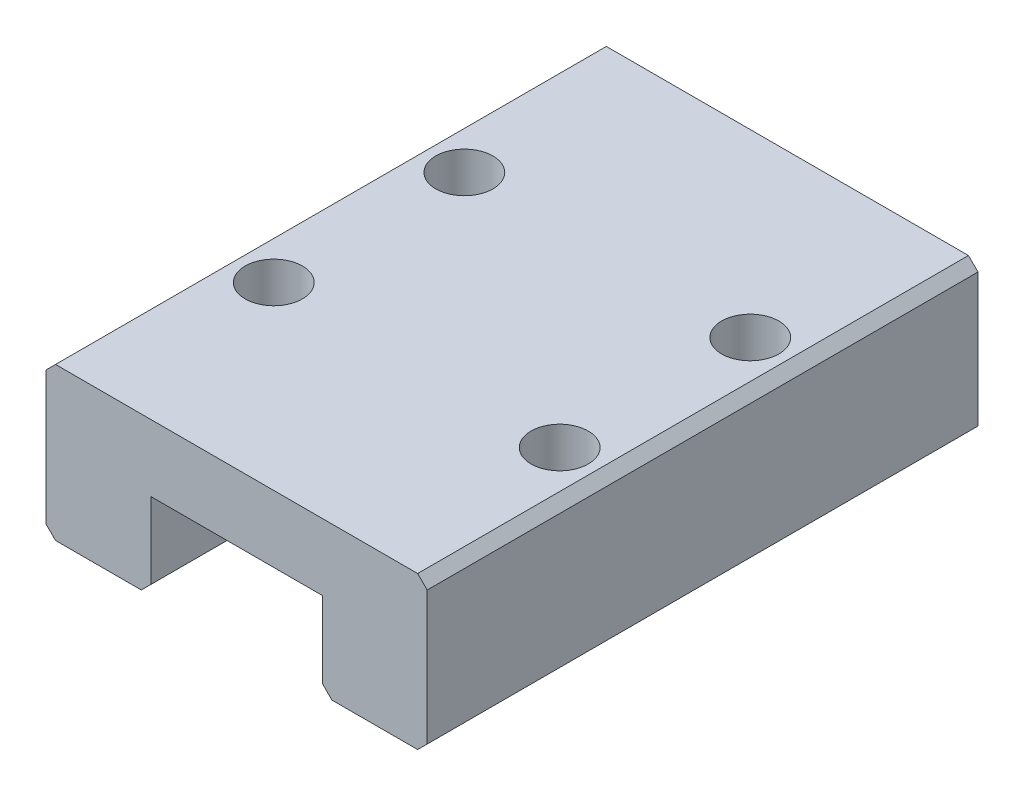
from build123d import *

# Parameters (mm, degrees)
EXTRUDE_1_DEPTH     = 14.45
SKETCH_2_R          = 1.5
CUT_EXTRUDE_1_DEPTH = 3
CHAMFER_1_SIZE      = 0.5


with BuildPart() as part:
    # 草图1 → 凸台-拉伸1 (new, symmetric)
    with BuildSketch(Plane.XY):
        Polygon((-4.5, 0), (-4.5, -4.5), (-10, -4.5), (-10, 3.5), (10, 3.5), (10, -4.5), (4.5, -4.5), (4.5, 0), align=None)
    extrude(amount=EXTRUDE_1_DEPTH, both=True)

    # 草图2 → 切除-拉伸1 (cut)
    with BuildSketch(Plane(origin=(0, 3.5, 0), x_dir=(1, 0, 0), z_dir=(0, 1, 0))):
        with Locations(Location((-7.5, 5, 0), (0, 0, 180))):
            Circle(SKETCH_2_R)
        with Locations(Location((7.5, 5, 0), (0, 0, 180))):
            Circle(SKETCH_2_R)
        with Locations(Location((-7.5, -5, 0), (0, 0, 180))):
            Circle(SKETCH_2_R)
        with Locations(Location((7.5, -5, 0), (0, 0, 180))):
            Circle(SKETCH_2_R)
    extrude(amount=-CUT_EXTRUDE_1_DEPTH, mode=Mode.SUBTRACT)

    # 倒角1
    chamfer_1_edges = [part.edges().sort_by_distance(p)[0] for p in [
        (-4.5, -4.5, 0),
        (-10, -4.5, 0),
        (-10, 3.5, 0),
        (10, 3.5, 0),
        (10, -4.5, 0),
        (4.5, -4.5, 0),
    ]]
    chamfer(chamfer_1_edges, length=CHAMFER_1_SIZE)


solid = part.part
